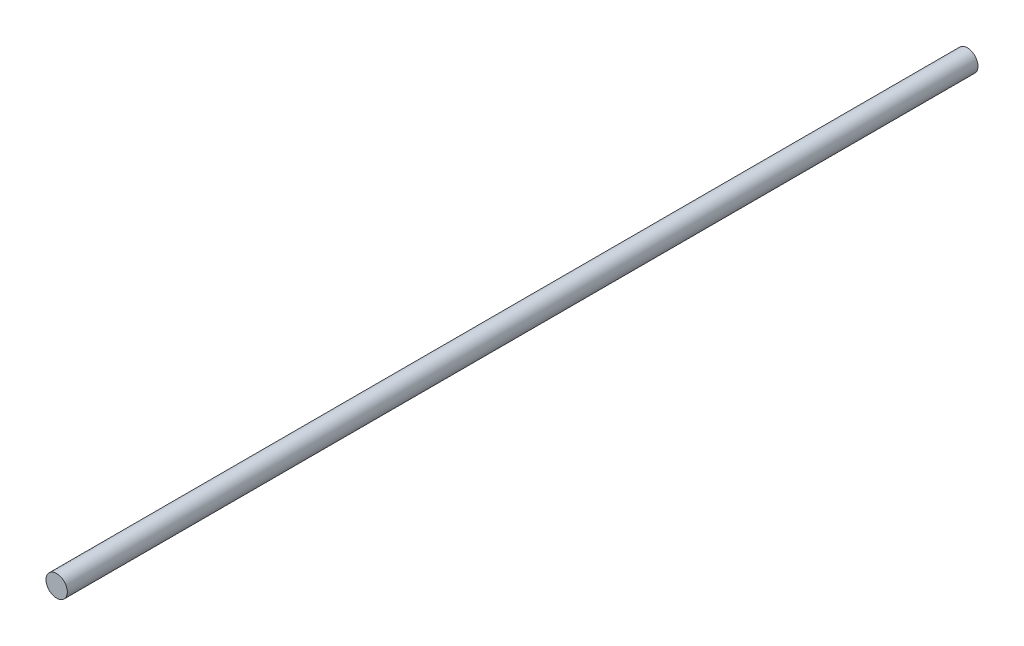
from build123d import *

# Parameters (mm, degrees)
SKETCH1_R           = 10
BOSS_EXTRUDE1_DEPTH = 853


with BuildPart() as part:
    # Sketch1 → Boss-Extrude1 (new body)
    with BuildSketch(Plane.XY.offset(650)):
        with Locations((0, 83.287247591)):
            Circle(SKETCH1_R)
    extrude(amount=BOSS_EXTRUDE1_DEPTH)


solid = part.part
